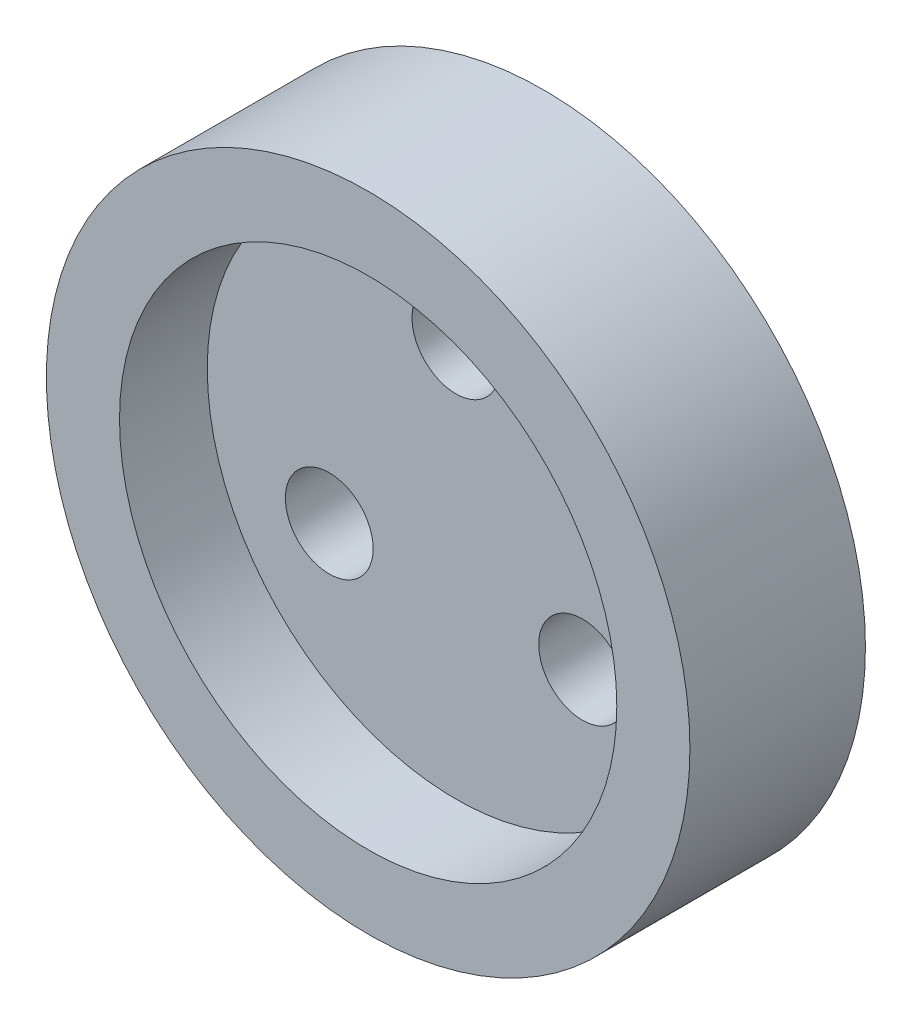
from build123d import *

# Parameters (mm, degrees)
ESQUISSE1_R        = 11
ESQUISSE1_R_2      = 1.5
BOSS_EXTRU_1_DEPTH = 3
ESQUISSE2_R        = 11
ESQUISSE2_R_2      = 8.5
BOSS_EXTRU_2_DEPTH = 3


with BuildPart() as part:
    # Esquisse1 → Boss.-Extru.1 (new body)
    with BuildSketch(Plane.XY):
        Circle(ESQUISSE1_R)
        with Locations((0, 5)):
            Circle(ESQUISSE1_R_2, mode=Mode.SUBTRACT)
        with Locations((4.330127019, -2.5)):
            Circle(ESQUISSE1_R_2, mode=Mode.SUBTRACT)
        with Locations((-4.330127019, -2.5)):
            Circle(ESQUISSE1_R_2, mode=Mode.SUBTRACT)
    extrude(amount=BOSS_EXTRU_1_DEPTH)

    # Esquisse2 → Boss.-Extru.2 (add)
    with BuildSketch(Plane.XY.offset(3)):
        Circle(ESQUISSE2_R)
        Circle(ESQUISSE2_R_2, mode=Mode.SUBTRACT)
    extrude(amount=BOSS_EXTRU_2_DEPTH)


solid = part.part
